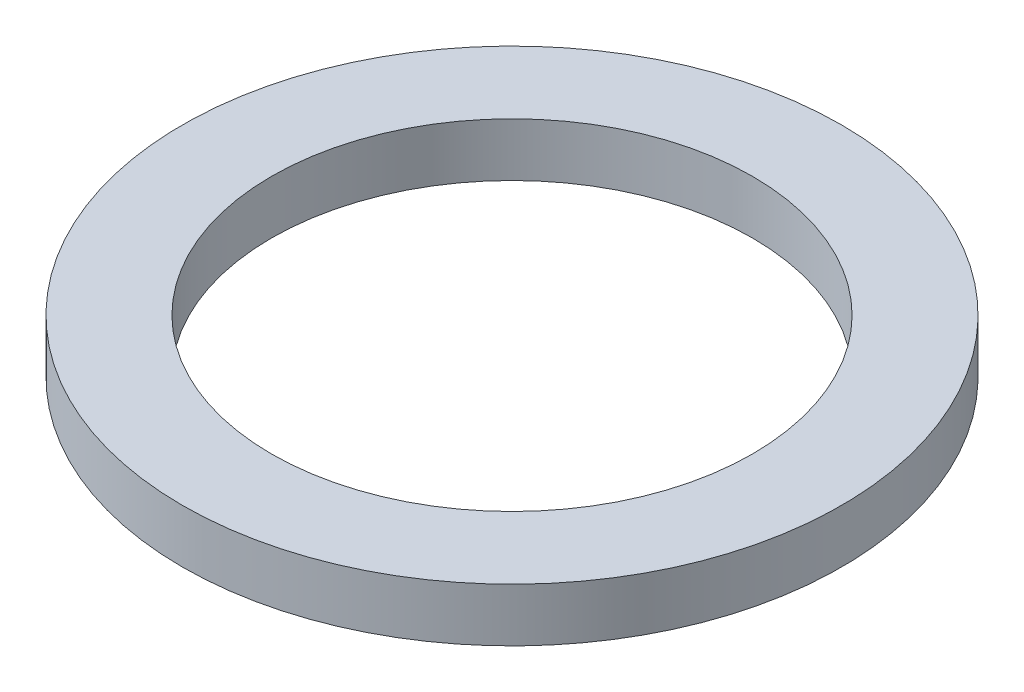
from build123d import *

# Parameters (mm, degrees)
SKETCH2_R           = 18.5
SKETCH2_R_2         = 13.5
BOSS_EXTRUDE1_DEPTH = 3


with BuildPart() as part:
    # Sketch2 → Boss-Extrude1 (new body)
    with BuildSketch(Plane(origin=(0, 0, 0), x_dir=(1, 0, 0), z_dir=(0, 1, 0))):
        with Locations(Location((0, 0, 0), (0, 0, 270))):
            Circle(SKETCH2_R)
        with Locations(Location((0, 0, 0), (0, 0, 270))):
            Circle(SKETCH2_R_2, mode=Mode.SUBTRACT)
    extrude(amount=BOSS_EXTRUDE1_DEPTH)


solid = part.part
